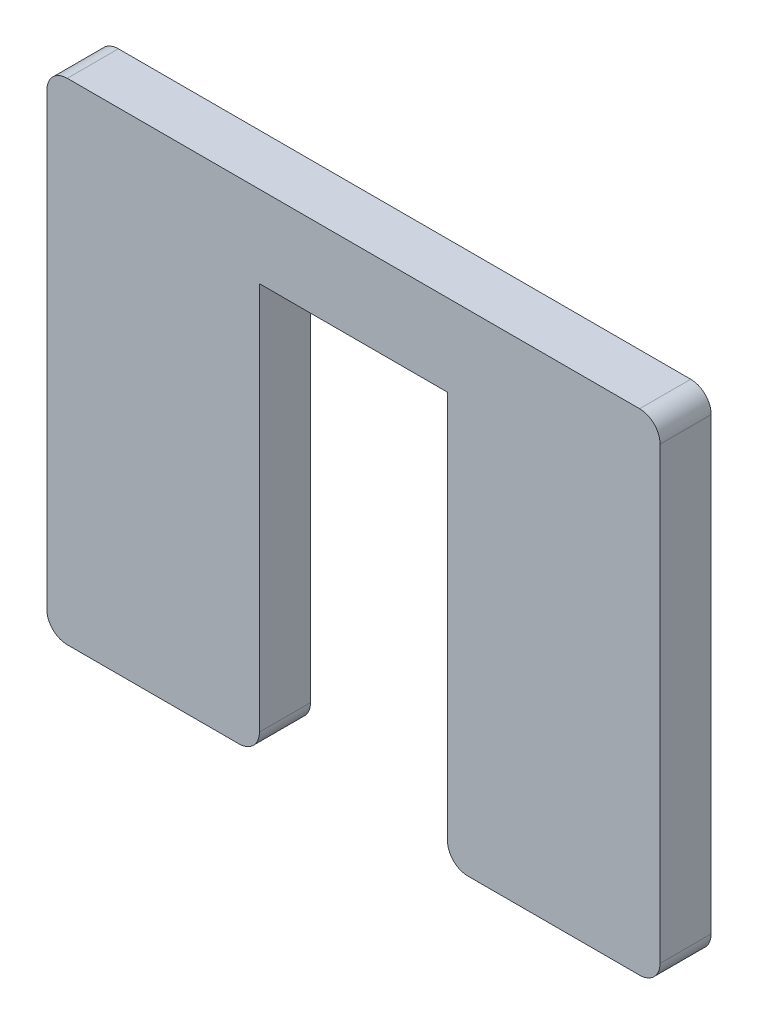
from build123d import *

# Parameters (mm, degrees)
EXTRUDE_1_DEPTH = 5
FILLET_1_R      = 2


with BuildPart() as part:
    # 草图1 → 凸台-拉伸1 (new body)
    with BuildSketch(Plane.XY):
        Polygon((-30, 24), (30, 24), (30, -24), (9.2, -24), (9.2, 16), (-9.2, 16), (-9.2, -24), (-30, -24), align=None)
    extrude(amount=EXTRUDE_1_DEPTH)

    # 圆角1
    fillet_1_edges = [part.edges().sort_by_distance(p)[0] for p in [
        (9.2, -24, 2.5),
        (-9.2, -24, 2.5),
        (-30, -24, 2.5),
        (-30, 24, 2.5),
        (30, 24, 2.5),
        (30, -24, 2.5),
    ]]
    fillet(fillet_1_edges, radius=FILLET_1_R)


solid = part.part
